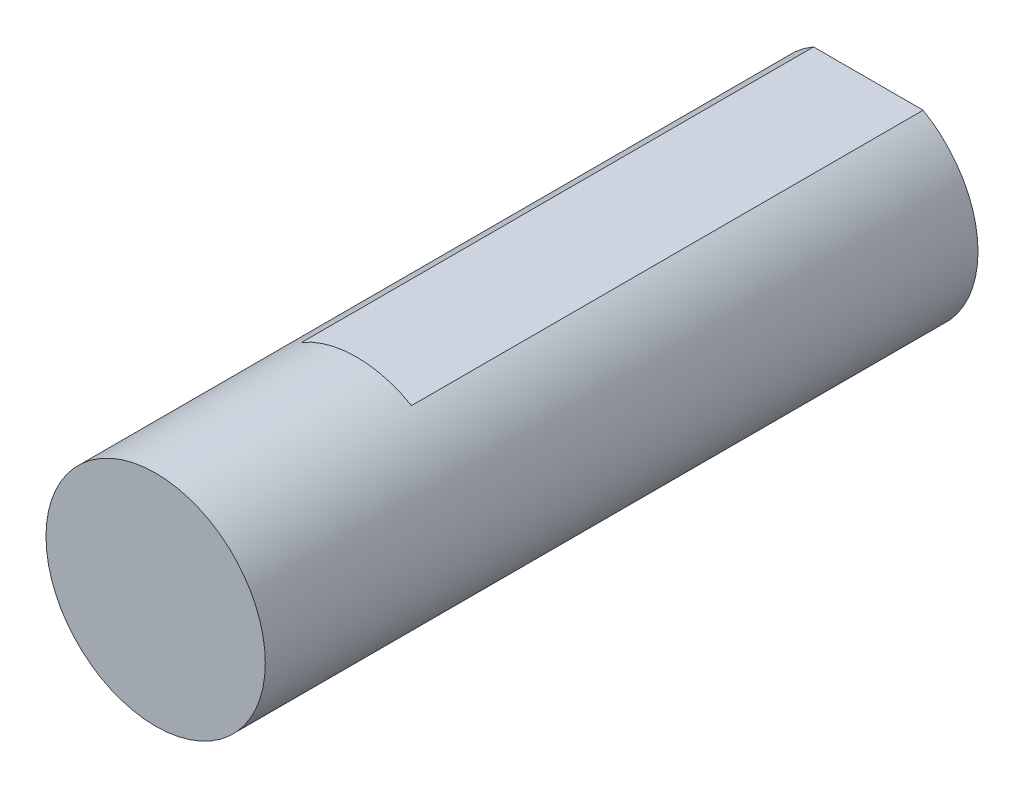
from build123d import *

# Parameters (mm, degrees)
SKETCH1_R           = 6
BOSS_EXTRUDE1_DEPTH = 39
CUT_EXTRUDE1_DEPTH  = 28


with BuildPart() as part:
    # Sketch1 → Boss-Extrude1 (new body)
    with BuildSketch(Plane.XY):
        Circle(SKETCH1_R)
    extrude(amount=BOSS_EXTRUDE1_DEPTH)

    # Sketch2 → Cut-Extrude1 (cut)
    with BuildSketch(Plane(origin=(0, 0, 0), x_dir=(-1, 0, 0), z_dir=(0, 0, -1))):
        Polygon((-41.730042052, 5.196152423), (-3, 5.196152423), (3, 5.196152423), (41.730042052, 5.196152423), (41.730042052, 82.656236526), (-41.730042052, 82.656236526), align=None)
    extrude(amount=-CUT_EXTRUDE1_DEPTH, mode=Mode.SUBTRACT)


solid = part.part
